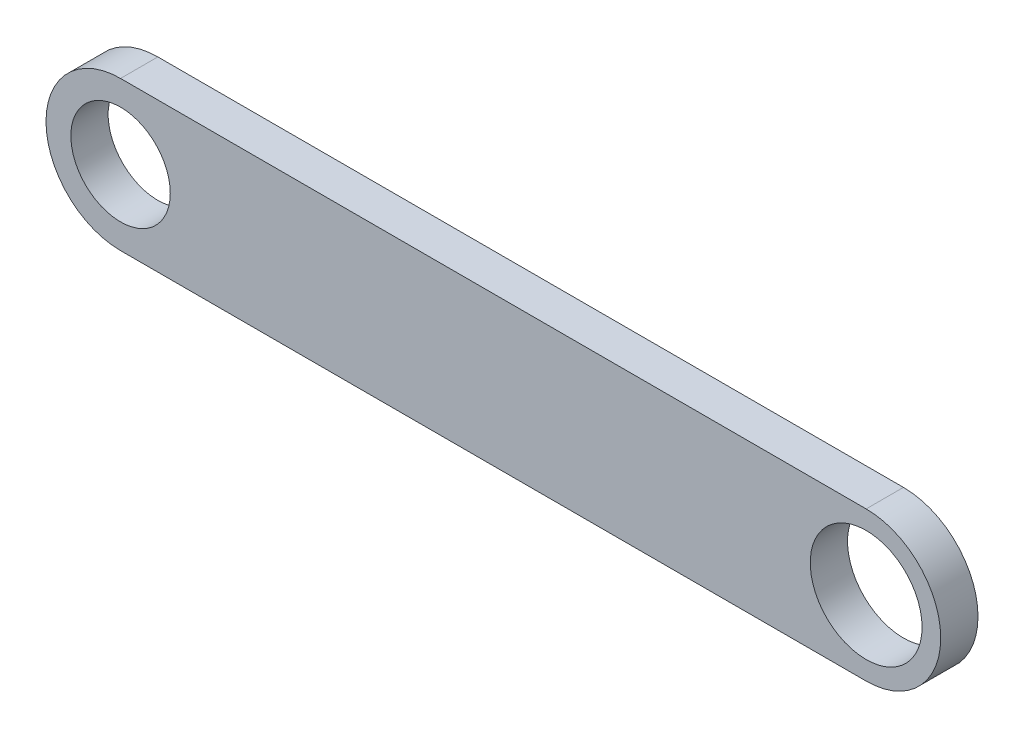
from build123d import *

# Parameters (mm, degrees)
SKETCH1_R           = 1.333333333
SKETCH1_R_2         = 1.5
BOSS_EXTRUDE2_DEPTH = 0.5


with BuildPart() as part:
    # Sketch1 → Boss-Extrude2 (new, symmetric)
    with BuildSketch(Plane.XY):
        with BuildLine():
            Line((-83.397280956, 53.337601666), (-63.397280956, 53.337601666))
            ThreePointArc((-63.397280956, 53.337601666), (-61.397280956, 51.337601666), (-63.397280956, 49.337601666))
            Line((-63.397280956, 49.337601666), (-83.397280956, 49.337601666))
            ThreePointArc((-83.397280956, 49.337601666), (-85.397280956, 51.337601666), (-83.397280956, 53.337601666))
        make_face()
        with Locations((-83.397280956, 51.337601666)):
            Circle(SKETCH1_R, mode=Mode.SUBTRACT)
        with Locations((-63.397280956, 51.337601666)):
            Circle(SKETCH1_R_2, mode=Mode.SUBTRACT)
    extrude(amount=BOSS_EXTRUDE2_DEPTH, both=True)


solid = part.part
